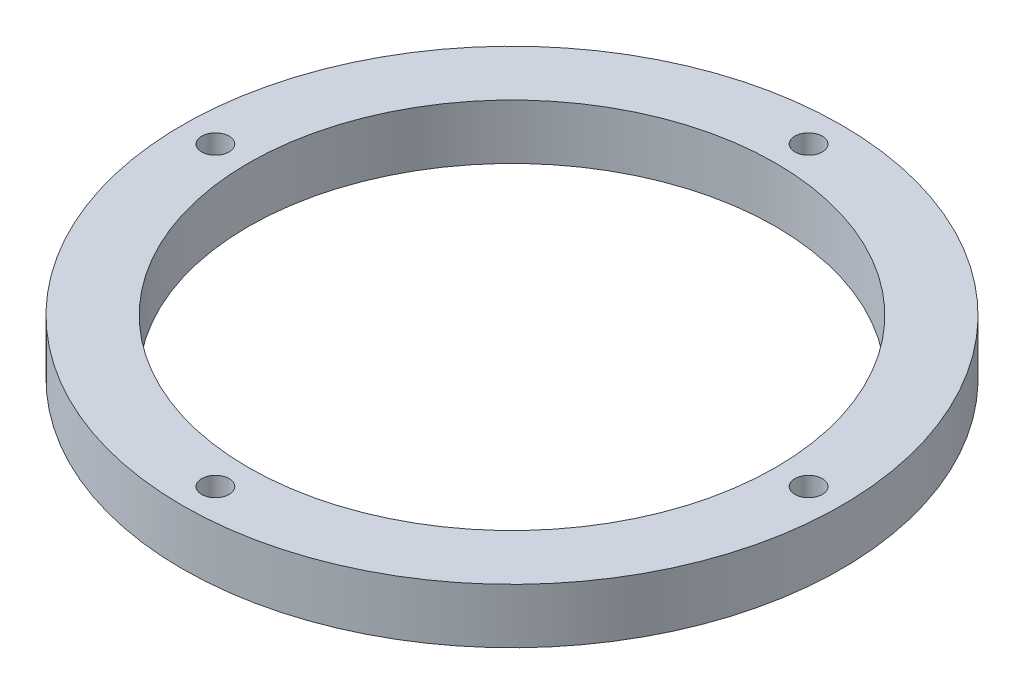
from build123d import *

# Parameters (mm, degrees)
SKETCH1_R           = 60
SKETCH1_R_2         = 48
SKETCH1_R_3         = 2.5
BOSS_EXTRUDE1_DEPTH = 10


with BuildPart() as part:
    # Sketch1 → Boss-Extrude1 (new body)
    with BuildSketch(Plane(origin=(0, 0, 0), x_dir=(1, 0, 0), z_dir=(0, 1, 0))):
        with Locations(Location((0, 0, 0), (0, 0, 270))):
            Circle(SKETCH1_R)
        with Locations(Location((0, 0, 0), (0, 0, 270))):
            Circle(SKETCH1_R_2, mode=Mode.SUBTRACT)
        with Locations(Location((-54, 0, 0), (0, 0, 270))):
            Circle(SKETCH1_R_3, mode=Mode.SUBTRACT)
        with Locations(Location((0, 54, 0), (0, 0, 270))):
            Circle(SKETCH1_R_3, mode=Mode.SUBTRACT)
        with Locations(Location((54, 0, 0), (0, 0, 270))):
            Circle(SKETCH1_R_3, mode=Mode.SUBTRACT)
        with Locations(Location((0, -54, 0), (0, 0, 270))):
            Circle(SKETCH1_R_3, mode=Mode.SUBTRACT)
    extrude(amount=BOSS_EXTRUDE1_DEPTH)


solid = part.part
